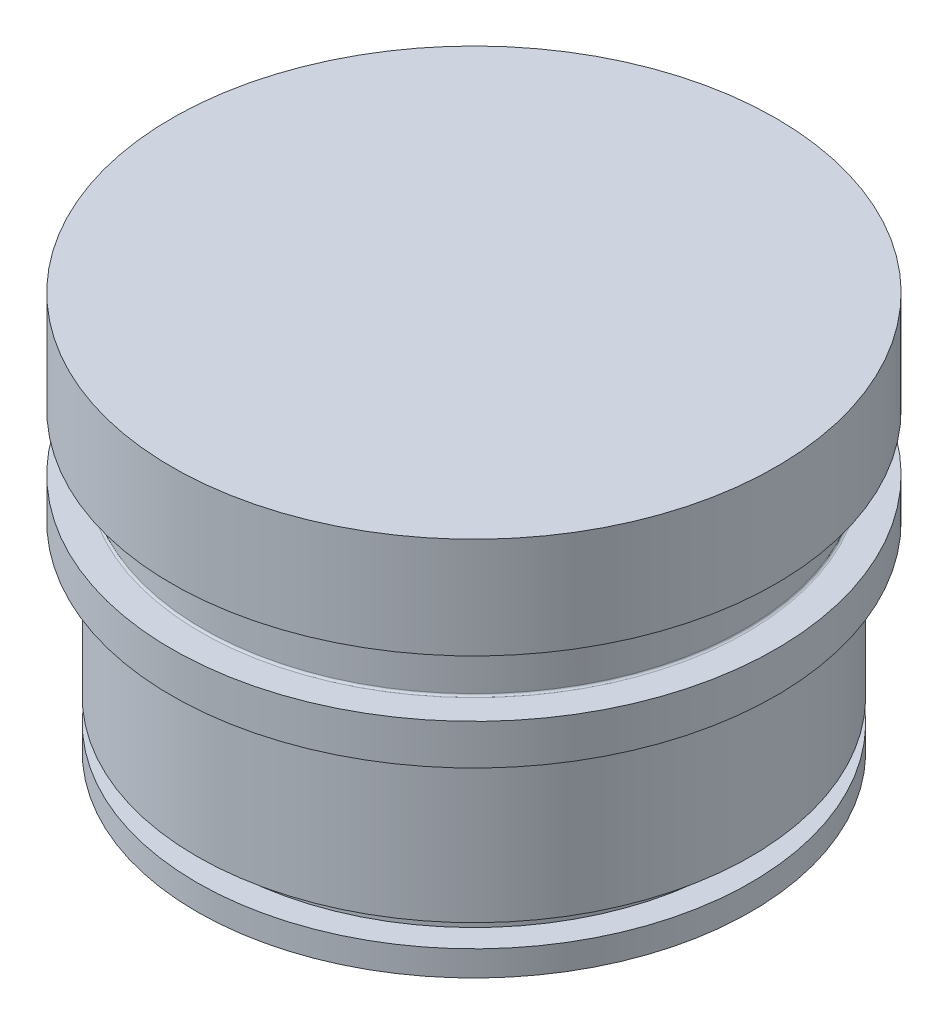
from build123d import *

# Parameters (mm, degrees)
FILLET4_R = 0.127


with BuildPart() as part:
    # Sketch1 → Revolve1 (revolve)
    with BuildSketch(Plane.XY):
        Polygon((0, 0), (-17.399, 0), (-17.399, 1.5875), (-15.7607, 1.5875), (-15.7607, 3.0099), (-17.399, 3.0099), (-17.399, 12.5349), (-18.9738, 12.5349), (-18.9738, 15.0749), (-17.018, 15.0749), (-17.018, 18.6309), (-18.9738, 18.6309), (-18.9738, 24.9809), (0, 24.9809), align=None)
    revolve(axis=Axis((0, 0, 0), (0, 1, 0)))

    # Fillet4
    fillet4_edges = [part.edges().sort_by_distance(p)[0] for p in [
        (17.018, 15.0749, 0),
        (17.018, 18.6309, 0),
    ]]
    fillet(fillet4_edges, radius=FILLET4_R)


solid = part.part
